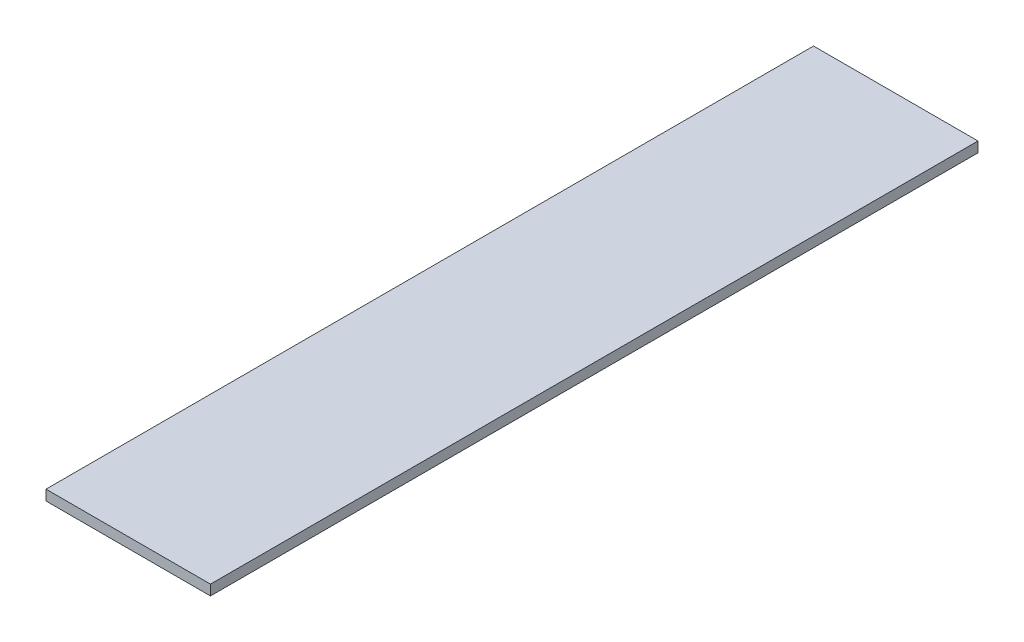
from build123d import *

# Parameters (mm, degrees)
SKETCH1_W           = 152.4
SKETCH1_H           = 711.2
BOSS_EXTRUDE1_DEPTH = 9.525


with BuildPart() as part:
    # Sketch1 → Boss-Extrude1 (new body)
    with BuildSketch(Plane(origin=(0, 0, 0), x_dir=(1, 0, 0), z_dir=(0, 1, 0))):
        Rectangle(SKETCH1_W, SKETCH1_H)
    extrude(amount=BOSS_EXTRUDE1_DEPTH)


solid = part.part
